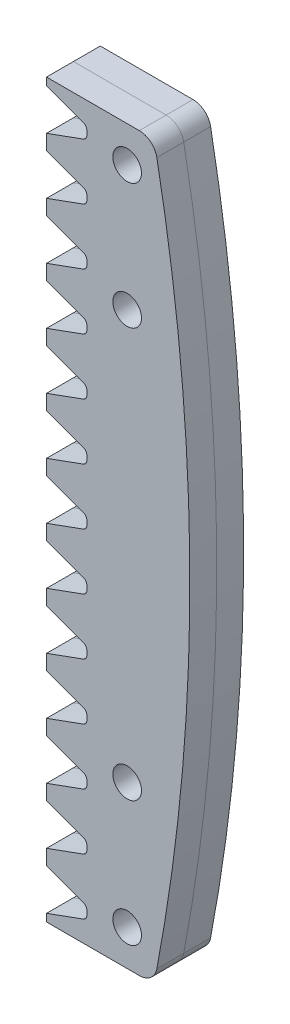
from build123d import *

# Parameters (mm, degrees)
SKETCHCI_M_STRSKETCHNAME_W = 11.99999997
SKETCHCI_M_STRSKETCHNAME_H = 81.681407766
CI_DEPTH                   = 1.5
CUT_EXTRUDE_585_DEPTH      = 80.188083481
PATTERN_LINEAR_641_COUNT   = 13
PATTERN_LINEAR_641_PITCH   = 6.283185307
SKETCH_7_R                 = 1.6
CUT_EXTRUDE_3_DEPTH        = 80.230692067
EXTRUDE_1_DEPTH            = 3
FILLET_1_R                 = 2
SKETCH_9_R                 = 1.6
EXTRUDE_2_DEPTH            = 3


with BuildPart() as part:
    # SketchCI.m_strSketchName → 拉伸CI (new, symmetric)
    with BuildSketch(Plane.XY):
        with Locations((4.000000015, -37.699111277)):
            Rectangle(SKETCHCI_M_STRSKETCHNAME_W, SKETCHCI_M_STRSKETCHNAME_H)
    extrude(amount=CI_DEPTH, both=True)

    # Sketch 514 → Cut-Extrude 585 (cut, symmetric)
    with BuildSketch(Plane.XY):
        with BuildLine():
            Line((-2.822919253, 2.598254885), (-2.822919253, -2.598254885))
            Line((-2.822919253, -2.598254885), (2.105212054, -0.804561779))
            ThreePointArc((2.105212054, -0.804561779), (2.391491191, -0.584892071), (2.499999962, -0.240746215))
            Line((2.499999962, -0.240746215), (2.499999962, 0.240746215))
            ThreePointArc((2.499999962, 0.240746215), (2.391491191, 0.584892071), (2.105212054, 0.804561779))
            Line((2.105212054, 0.804561779), (-2.822919253, 2.598254885))
        make_face()
    cut_extrude_585 = extrude(amount=CUT_EXTRUDE_585_DEPTH, both=True, mode=Mode.SUBTRACT)

    # Pattern Linear 641: Cut-Extrude 585 ×13
    with Locations(*[(0, -i * PATTERN_LINEAR_641_PITCH, 0) for i in range(1, PATTERN_LINEAR_641_COUNT)]):
        add(cut_extrude_585, mode=Mode.SUBTRACT)

    # 草图7 → 切除-拉伸3 (cut, through all)
    with BuildSketch(Plane(origin=(0, 0, -1.5), x_dir=(-1, 0, 0), z_dir=(0, 0, -1))):
        with Locations((-7, -14.858407394)):
            Circle(SKETCH_7_R)
        with Locations((-7, -0.858407394)):
            Circle(SKETCH_7_R)
        with Locations(Location((-7, -74.539816293, 0), (0, 0, 180))):
            Circle(SKETCH_7_R)
        with Locations(Location((-7, -60.539816293, 0), (0, 0, 180))):
            Circle(SKETCH_7_R)
    extrude(amount=-CUT_EXTRUDE_3_DEPTH, mode=Mode.SUBTRACT)

    # 草图8 → 凸台-拉伸1 (add)
    with BuildSketch(Plane(origin=(0, 0, -1.5), x_dir=(-1, 0, 0), z_dir=(0, 0, -1))):
        with BuildLine():
            Line((-10, -78.53981516), (-10, 3.141592606))
            ThreePointArc((-10, 3.141592606), (-14, -37.699111277), (-10, -78.53981516))
        make_face()
    extrude(amount=-EXTRUDE_1_DEPTH)

    # 圆角1
    fillet_1_edges = [part.edges().sort_by_distance(p)[0] for p in [
        (10, 3.141592606, 0),
        (10, -78.53981516, 0),
    ]]
    fillet(fillet_1_edges, radius=FILLET_1_R)


with BuildPart() as body_2:
    # 草图9 → 凸台-拉伸2 (new body)
    with BuildSketch(Plane.XY.offset(1.5)):
        with BuildLine():
            Line((8.35022833, 3.141592606), (-1.99999997, 3.141592606))
            Line((-1.99999997, 3.141592606), (-1.99999997, 2.298736761))
            Line((-1.99999997, 2.298736761), (2.105212054, 0.804561779))
            ThreePointArc((2.105212054, 0.804561779), (2.391491191, 0.584892071), (2.499999962, 0.240746215))
            Line((2.499999962, 0.240746215), (2.499999962, -0.240746215))
            ThreePointArc((2.499999962, -0.240746215), (2.391491191, -0.584892071), (2.105212054, -0.804561779))
            Line((2.105212054, -0.804561779), (-1.99999997, -2.298736761))
            Line((-1.99999997, -2.298736761), (-1.99999997, -3.984448546))
            Line((-1.99999997, -3.984448546), (2.105212054, -5.478623529))
            ThreePointArc((2.105212054, -5.478623529), (2.391491191, -5.698293236), (2.499999962, -6.042439093))
            Line((2.499999962, -6.042439093), (2.499999962, -6.523931522))
            ThreePointArc((2.499999962, -6.523931522), (2.391491191, -6.868077378), (2.105212054, -7.087747086))
            Line((2.105212054, -7.087747086), (-1.99999997, -8.581922068))
            Line((-1.99999997, -8.581922068), (-1.99999997, -10.267633854))
            Line((-1.99999997, -10.267633854), (2.105212054, -11.761808836))
            ThreePointArc((2.105212054, -11.761808836), (2.391491191, -11.981478543), (2.499999962, -12.3256244))
            Line((2.499999962, -12.3256244), (2.499999962, -12.807116829))
            ThreePointArc((2.499999962, -12.807116829), (2.391491191, -13.151262686), (2.105212054, -13.370932393))
            Line((2.105212054, -13.370932393), (-1.99999997, -14.865107375))
            Line((-1.99999997, -14.865107375), (-1.99999997, -16.550819161))
            Line((-1.99999997, -16.550819161), (2.105212054, -18.044994143))
            ThreePointArc((2.105212054, -18.044994143), (2.391491191, -18.26466385), (2.499999962, -18.608809707))
            Line((2.499999962, -18.608809707), (2.499999962, -19.090302136))
            ThreePointArc((2.499999962, -19.090302136), (2.391491191, -19.434447993), (2.105212054, -19.6541177))
            Line((2.105212054, -19.6541177), (-1.99999997, -21.148292682))
            Line((-1.99999997, -21.148292682), (-1.99999997, -22.834004468))
            Line((-1.99999997, -22.834004468), (2.105212054, -24.32817945))
            ThreePointArc((2.105212054, -24.32817945), (2.391491191, -24.547849157), (2.499999962, -24.891995014))
            Line((2.499999962, -24.891995014), (2.499999962, -25.373487443))
            ThreePointArc((2.499999962, -25.373487443), (2.391491191, -25.7176333), (2.105212054, -25.937303007))
            Line((2.105212054, -25.937303007), (-1.99999997, -27.43147799))
            Line((-1.99999997, -27.43147799), (-1.99999997, -29.117189775))
            Line((-1.99999997, -29.117189775), (2.105212054, -30.611364757))
            ThreePointArc((2.105212054, -30.611364757), (2.391491191, -30.831034465), (2.499999962, -31.175180321))
            Line((2.499999962, -31.175180321), (2.499999962, -31.65667275))
            ThreePointArc((2.499999962, -31.65667275), (2.391491191, -32.000818607), (2.105212054, -32.220488314))
            Line((2.105212054, -32.220488314), (-1.99999997, -33.714663297))
            Line((-1.99999997, -33.714663297), (-1.99999997, -35.400375082))
            Line((-1.99999997, -35.400375082), (2.105212054, -36.894550064))
            ThreePointArc((2.105212054, -36.894550064), (2.391491191, -37.114219772), (2.499999962, -37.458365628))
            Line((2.499999962, -37.458365628), (2.499999962, -37.939858058))
            ThreePointArc((2.499999962, -37.939858058), (2.391491191, -38.284003914), (2.105212054, -38.503673622))
            Line((2.105212054, -38.503673622), (-1.99999997, -39.997848604))
            Line((-1.99999997, -39.997848604), (-1.99999997, -41.683560389))
            Line((-1.99999997, -41.683560389), (2.105212054, -43.177735372))
            ThreePointArc((2.105212054, -43.177735372), (2.391491191, -43.397405079), (2.499999962, -43.741550936))
            Line((2.499999962, -43.741550936), (2.499999962, -44.223043365))
            ThreePointArc((2.499999962, -44.223043365), (2.391491191, -44.567189221), (2.105212054, -44.786858929))
            Line((2.105212054, -44.786858929), (-1.99999997, -46.281033911))
            Line((-1.99999997, -46.281033911), (-1.99999997, -47.966745697))
            Line((-1.99999997, -47.966745697), (2.105212054, -49.460920679))
            ThreePointArc((2.105212054, -49.460920679), (2.391491191, -49.680590386), (2.499999962, -50.024736243))
            Line((2.499999962, -50.024736243), (2.499999962, -50.506228672))
            ThreePointArc((2.499999962, -50.506228672), (2.391491191, -50.850374529), (2.105212054, -51.070044236))
            Line((2.105212054, -51.070044236), (-1.99999997, -52.564219218))
            Line((-1.99999997, -52.564219218), (-1.99999997, -54.249931004))
            Line((-1.99999997, -54.249931004), (2.105212054, -55.744105986))
            ThreePointArc((2.105212054, -55.744105986), (2.391491191, -55.963775693), (2.499999962, -56.30792155))
            Line((2.499999962, -56.30792155), (2.499999962, -56.789413979))
            ThreePointArc((2.499999962, -56.789413979), (2.391491191, -57.133559836), (2.105212054, -57.353229543))
            Line((2.105212054, -57.353229543), (-1.99999997, -58.847404525))
            Line((-1.99999997, -58.847404525), (-1.99999997, -60.533116311))
            Line((-1.99999997, -60.533116311), (2.105212054, -62.027291293))
            ThreePointArc((2.105212054, -62.027291293), (2.391491191, -62.246961001), (2.499999962, -62.591106857))
            Line((2.499999962, -62.591106857), (2.499999962, -63.072599286))
            ThreePointArc((2.499999962, -63.072599286), (2.391491191, -63.416745143), (2.105212054, -63.63641485))
            Line((2.105212054, -63.63641485), (-1.99999997, -65.130589833))
            Line((-1.99999997, -65.130589833), (-1.99999997, -66.816301618))
            Line((-1.99999997, -66.816301618), (2.105212054, -68.3104766))
            ThreePointArc((2.105212054, -68.3104766), (2.391491191, -68.530146308), (2.499999962, -68.874292164))
            Line((2.499999962, -68.874292164), (2.499999962, -69.355784594))
            ThreePointArc((2.499999962, -69.355784594), (2.391491191, -69.69993045), (2.105212054, -69.919600158))
            Line((2.105212054, -69.919600158), (-1.99999997, -71.41377514))
            Line((-1.99999997, -71.41377514), (-1.99999997, -73.099486925))
            Line((-1.99999997, -73.099486925), (2.105212054, -74.593661908))
            ThreePointArc((2.105212054, -74.593661908), (2.391491191, -74.813331615), (2.499999962, -75.157477472))
            Line((2.499999962, -75.157477472), (2.499999962, -75.638969901))
            ThreePointArc((2.499999962, -75.638969901), (2.391491191, -75.983115757), (2.105212054, -76.202785465))
            Line((2.105212054, -76.202785465), (-1.99999997, -77.696960447))
            Line((-1.99999997, -77.696960447), (-1.99999997, -78.53981516))
            Line((-1.99999997, -78.53981516), (8.35022833, -78.53981516))
            ThreePointArc((8.35022833, -78.53981516), (9.625931688, -78.080133615), (10.315217755, -76.912396103))
            ThreePointArc((10.315217755, -76.912396103), (14, -37.699111277), (10.315217755, 1.514173549))
            ThreePointArc((10.315217755, 1.514173549), (9.625931688, 2.681911061), (8.35022833, 3.141592606))
        make_face()
        with Locations((7, -0.858407394)):
            Circle(SKETCH_9_R, mode=Mode.SUBTRACT)
        with Locations((7, -14.858407394)):
            Circle(SKETCH_9_R, mode=Mode.SUBTRACT)
        with Locations((7, -60.539816293)):
            Circle(SKETCH_9_R, mode=Mode.SUBTRACT)
        with Locations((7, -74.539816293)):
            Circle(SKETCH_9_R, mode=Mode.SUBTRACT)
    extrude(amount=EXTRUDE_2_DEPTH)


solid = Compound([part.part, body_2.part])
